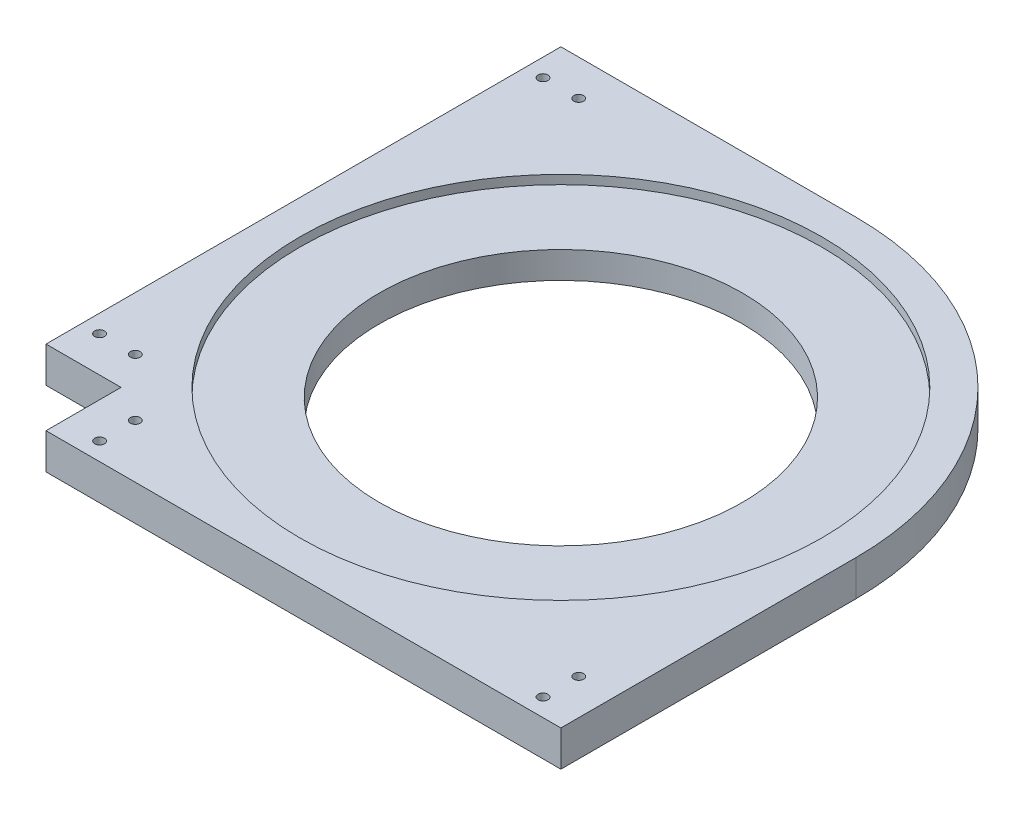
from build123d import *

# Parameters (mm, degrees)
BOSS_EXTRUDE1_DEPTH = 20
SKETCH2_R           = 146.05
CUT_EXTRUDE1_DEPTH  = 5
CUT_EXTRUDE2_REACH  = 235.968
SKETCH3_R           = 101.6
CUT_EXTRUDE3_REACH  = 236.342
SKETCH4_W           = 42
SKETCH4_H           = 42
CUT_EXTRUDE4_REACH  = 236.342
SKETCH5_R           = 2.75


with BuildPart() as part:
    # Sketch1 → Boss-Extrude1 (new body)
    with BuildSketch(Plane(origin=(0, 0, 0), x_dir=(1, 0, 0), z_dir=(0, 1, 0))):
        with BuildLine():
            Line((165.1, 0), (165.1, -165.1))
            Line((165.1, -165.1), (-165.1, -165.1))
            Line((-165.1, -165.1), (-165.1, 165.1))
            Line((-165.1, 165.1), (0, 165.1))
            ThreePointArc((0, 165.1), (116.743329574, 116.743329574), (165.1, 0))
        make_face()
    extrude(amount=BOSS_EXTRUDE1_DEPTH)

    # Sketch2 → Cut-Extrude1 (cut)
    with BuildSketch(Plane(origin=(0, 20, 0), x_dir=(1, 0, 0), z_dir=(0, 1, 0))):
        with Locations(Location((0, 0, 0), (0, 0, 270))):
            Circle(SKETCH2_R)
    extrude(amount=-CUT_EXTRUDE1_DEPTH, mode=Mode.SUBTRACT)

    # Sketch3 → Cut-Extrude2 (cut, up to next)
    with BuildSketch(Plane(origin=(0, 15, 0), x_dir=(1, 0, 0), z_dir=(0, 1, 0)), mode=Mode.PRIVATE) as cut_extrude2_sk1:
        with Locations(Location((0, 0, 0), (0, 0, 270))):
            Circle(SKETCH3_R)
    cut_extrude2_tool1 = extrude(cut_extrude2_sk1.sketch, amount=-CUT_EXTRUDE2_REACH, mode=Mode.PRIVATE) & part.part
    add(cut_extrude2_tool1.solids().sort_by_distance((0, 15, 0))[0], mode=Mode.SUBTRACT)

    # Sketch4 → Cut-Extrude3 (cut, up to next)
    with BuildSketch(Plane(origin=(0, 20, 0), x_dir=(1, 0, 0), z_dir=(0, 1, 0)), mode=Mode.PRIVATE) as cut_extrude3_sk1:
        with Locations((-144.1, -144.1)):
            Rectangle(SKETCH4_W, SKETCH4_H)
    cut_extrude3_tool1 = extrude(cut_extrude3_sk1.sketch, amount=-CUT_EXTRUDE3_REACH, mode=Mode.PRIVATE) & part.part
    add(cut_extrude3_tool1.solids().sort_by_distance((-144.1, 20, 144.1))[0], mode=Mode.SUBTRACT)

    # Sketch5 → Cut-Extrude4 (cut, up to next)
    with BuildSketch(Plane(origin=(0, 20, 0), x_dir=(1, 0, 0), z_dir=(0, 1, 0)), mode=Mode.PRIVATE) as cut_extrude4_sk1:
        with Locations(Location((-103.1, -135.1, 0), (0, 0, 270))):
            Circle(SKETCH5_R)
    cut_extrude4_tool1 = extrude(cut_extrude4_sk1.sketch, amount=-CUT_EXTRUDE4_REACH, mode=Mode.PRIVATE) & part.part
    # Sketch5 → Cut-Extrude4 (cut, up to next)
    with BuildSketch(Plane(origin=(0, 20, 0), x_dir=(1, 0, 0), z_dir=(0, 1, 0)), mode=Mode.PRIVATE) as cut_extrude4_sk2:
        with Locations(Location((145.1, -135.1, 0), (0, 0, 270))):
            Circle(SKETCH5_R)
    cut_extrude4_tool2 = extrude(cut_extrude4_sk2.sketch, amount=-CUT_EXTRUDE4_REACH, mode=Mode.PRIVATE) & part.part
    # Sketch5 → Cut-Extrude4 (cut, up to next)
    with BuildSketch(Plane(origin=(0, 20, 0), x_dir=(1, 0, 0), z_dir=(0, 1, 0)), mode=Mode.PRIVATE) as cut_extrude4_sk3:
        with Locations(Location((-103.1, -155.1, 0), (0, 0, 270))):
            Circle(SKETCH5_R)
    cut_extrude4_tool3 = extrude(cut_extrude4_sk3.sketch, amount=-CUT_EXTRUDE4_REACH, mode=Mode.PRIVATE) & part.part
    # Sketch5 → Cut-Extrude4 (cut, up to next)
    with BuildSketch(Plane(origin=(0, 20, 0), x_dir=(1, 0, 0), z_dir=(0, 1, 0)), mode=Mode.PRIVATE) as cut_extrude4_sk4:
        with Locations(Location((145.1, -155.1, 0), (0, 0, 270))):
            Circle(SKETCH5_R)
    cut_extrude4_tool4 = extrude(cut_extrude4_sk4.sketch, amount=-CUT_EXTRUDE4_REACH, mode=Mode.PRIVATE) & part.part
    # Sketch5 → Cut-Extrude4 (cut, up to next)
    with BuildSketch(Plane(origin=(0, 20, 0), x_dir=(1, 0, 0), z_dir=(0, 1, 0)), mode=Mode.PRIVATE) as cut_extrude4_sk5:
        with Locations(Location((-155.1, 145.1, 0), (0, 0, 270))):
            Circle(SKETCH5_R)
    cut_extrude4_tool5 = extrude(cut_extrude4_sk5.sketch, amount=-CUT_EXTRUDE4_REACH, mode=Mode.PRIVATE) & part.part
    # Sketch5 → Cut-Extrude4 (cut, up to next)
    with BuildSketch(Plane(origin=(0, 20, 0), x_dir=(1, 0, 0), z_dir=(0, 1, 0)), mode=Mode.PRIVATE) as cut_extrude4_sk6:
        with Locations(Location((-155.1, -103.1, 0), (0, 0, 270))):
            Circle(SKETCH5_R)
    cut_extrude4_tool6 = extrude(cut_extrude4_sk6.sketch, amount=-CUT_EXTRUDE4_REACH, mode=Mode.PRIVATE) & part.part
    # Sketch5 → Cut-Extrude4 (cut, up to next)
    with BuildSketch(Plane(origin=(0, 20, 0), x_dir=(1, 0, 0), z_dir=(0, 1, 0)), mode=Mode.PRIVATE) as cut_extrude4_sk7:
        with Locations(Location((-135.1, 145.1, 0), (0, 0, 270))):
            Circle(SKETCH5_R)
    cut_extrude4_tool7 = extrude(cut_extrude4_sk7.sketch, amount=-CUT_EXTRUDE4_REACH, mode=Mode.PRIVATE) & part.part
    # Sketch5 → Cut-Extrude4 (cut, up to next)
    with BuildSketch(Plane(origin=(0, 20, 0), x_dir=(1, 0, 0), z_dir=(0, 1, 0)), mode=Mode.PRIVATE) as cut_extrude4_sk8:
        with Locations(Location((-135.1, -103.1, 0), (0, 0, 270))):
            Circle(SKETCH5_R)
    cut_extrude4_tool8 = extrude(cut_extrude4_sk8.sketch, amount=-CUT_EXTRUDE4_REACH, mode=Mode.PRIVATE) & part.part
    add(cut_extrude4_tool1.solids().sort_by_distance((-103.1, 20, 135.1))[0], mode=Mode.SUBTRACT)
    add(cut_extrude4_tool2.solids().sort_by_distance((145.1, 20, 135.1))[0], mode=Mode.SUBTRACT)
    add(cut_extrude4_tool3.solids().sort_by_distance((-103.1, 20, 155.1))[0], mode=Mode.SUBTRACT)
    add(cut_extrude4_tool4.solids().sort_by_distance((145.1, 20, 155.1))[0], mode=Mode.SUBTRACT)
    add(cut_extrude4_tool5.solids().sort_by_distance((-155.1, 20, -145.1))[0], mode=Mode.SUBTRACT)
    add(cut_extrude4_tool6.solids().sort_by_distance((-155.1, 20, 103.1))[0], mode=Mode.SUBTRACT)
    add(cut_extrude4_tool7.solids().sort_by_distance((-135.1, 20, -145.1))[0], mode=Mode.SUBTRACT)
    add(cut_extrude4_tool8.solids().sort_by_distance((-135.1, 20, 103.1))[0], mode=Mode.SUBTRACT)


solid = part.part
